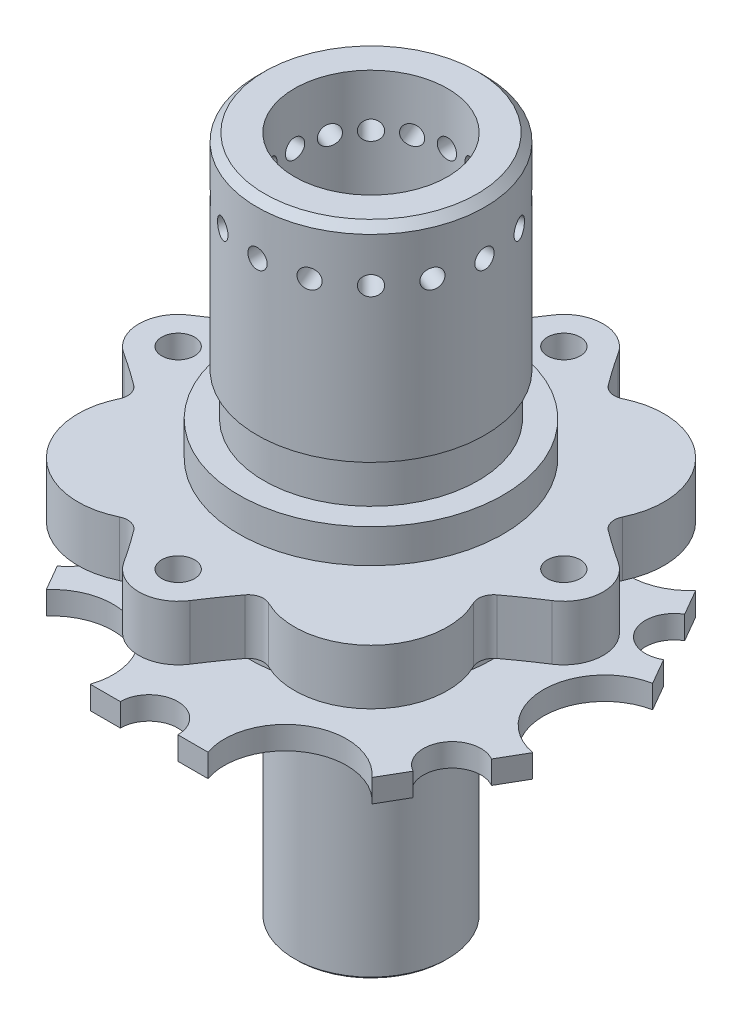
from build123d import *

# Parameters (mm, degrees)
SKETCH5_W                     = 15.875
SKETCH5_H                     = 79.375
SKETCH7_W                     = 3.4
SKETCH7_H                     = 69.85
DRIVE_PIN_HOLES_PATTERN_COUNT = 4
FLANGE_SUPPORT_CUT_REACH      = 104.834
SKETCH8_R                     = 52.5
BRAKE_HAT_HEX_DEPTH           = 4.7625
F_5_16_CLEARNCE_D             = 8.2042
SKETCH14_R                    = 2
PIN_HOLES_DEPTH               = 99.496921864
PIN_HOLE_PATTERN_COUNT        = 16
SKETCH11_R                    = 3.175
TRIPOD_PINS_DEPTH             = 12.7
FILLET1_R                     = 3.175
CIRPATTERN1_COUNT             = 4


with BuildPart() as part:
    # Sketch1 → Bearing Shaft/Flange Support (revolve)
    with BuildSketch(Plane(origin=(0, 0, 0), x_dir=(0, 0, -1), z_dir=(1, 0, 0)), mode=Mode.PRIVATE) as bearing_shaft_flange_support_sk:
        Polygon((0, 0), (-25.0825, 0), (-25.0825, -12.319), (-47.625, -12.319), (-47.625, -17.0815), (-25.0825, -17.0815), (-15.875, -17.0815), (-15.875, -70.64248), (-15.367, -71.15048), (0, -71.15048), align=None)
    revolve(bearing_shaft_flange_support_sk.sketch.rotate(Axis((0, 0, 0), (0, 1, 0)), 180), axis=Axis((0, 0, 0), (0, 1, 0)))

    # Sketch2 → Drive Pin Support (revolve)
    with BuildSketch(Plane(origin=(0, 0, 0), x_dir=(0, 0, -1), z_dir=(1, 0, 0)), mode=Mode.PRIVATE) as drive_pin_support_sk:
        Polygon((0, 0), (-52.5, 0), (-52.5, 11.43), (-27.4096, 11.43), (-27.4096, 18.43), (-22.225, 18.43), (-22.225, 27.305), (-23.61946, 27.305), (-23.61946, 68.2625), (-22.03196, 69.85), (0, 69.85), align=None)
    revolve(drive_pin_support_sk.sketch.rotate(Axis((0, 0, 0), (0, 1, 0)), 180), axis=Axis((0, 0, 0), (0, 1, 0)))

    # Sketch5 → Center Mass Removal (revolve, cut)
    with BuildSketch(Plane(origin=(0, 0, 0), x_dir=(0, 0, -1), z_dir=(1, 0, 0)), mode=Mode.PRIVATE) as center_mass_removal_sk:
        with Locations((7.9375, 30.1625)):
            Rectangle(SKETCH5_W, SKETCH5_H)
    revolve(center_mass_removal_sk.sketch.rotate(Axis((0, 0, 0), (0, -1, 0)), 180), axis=Axis((0, 0, 0), (0, -1, 0)), mode=Mode.SUBTRACT)

    # Sketch7 → Drive Pin Holes (revolve, cut)
    with BuildSketch(Plane(origin=(0, 0, 40), x_dir=(0, 0, -1), z_dir=(1, 0, 0))):
        with Locations((1.7, 34.925)):
            Rectangle(SKETCH7_W, SKETCH7_H)
    drive_pin_holes = revolve(axis=Axis((0, -6.35, 40), (0, 1, 0)), mode=Mode.SUBTRACT)

    # Drive Pin Holes Pattern: Drive Pin Holes ×4 about axis
    drive_pin_holes_pattern_axis = Axis((0, 0, 0), (0, 1, 0))
    for i in range(1, DRIVE_PIN_HOLES_PATTERN_COUNT):
        add(drive_pin_holes.rotate(drive_pin_holes_pattern_axis, i * 360 / DRIVE_PIN_HOLES_PATTERN_COUNT), mode=Mode.SUBTRACT)

    # Sketch8 → Flange Support Cut (cut, up to next)
    with BuildSketch(Plane.XZ, mode=Mode.PRIVATE) as flange_support_cut_sk1:
        Circle(SKETCH8_R)
        with BuildLine():
            ThreePointArc((6.851776468, 44.436165629), (0, 48.1625), (-6.851776468, 44.436165629))
            ThreePointArc((-6.851776468, 44.436165629), (-9.964767607, 39.850591878), (-13.274865482, 35.405206349))
            ThreePointArc((-13.274865482, 35.405206349), (-33.675960454, 33.675960454), (-35.405206349, 13.274865482))
            ThreePointArc((-35.405206349, 13.274865482), (-39.850591878, 9.964767607), (-44.436165629, 6.851776468))
            ThreePointArc((-44.436165629, 6.851776468), (-48.1625, 0), (-44.436165629, -6.851776468))
            ThreePointArc((-44.436165629, -6.851776468), (-39.850591878, -9.964767607), (-35.405206349, -13.274865482))
            ThreePointArc((-35.405206349, -13.274865482), (-33.675960454, -33.675960454), (-13.274865482, -35.405206349))
            ThreePointArc((-13.274865482, -35.405206349), (-9.964767607, -39.850591878), (-6.851776468, -44.436165629))
            ThreePointArc((-6.851776468, -44.436165629), (0, -48.1625), (6.851776468, -44.436165629))
            ThreePointArc((6.851776468, -44.436165629), (9.964767607, -39.850591878), (13.274865482, -35.405206349))
            ThreePointArc((13.274865482, -35.405206349), (33.675960454, -33.675960454), (35.405206349, -13.274865482))
            ThreePointArc((35.405206349, -13.274865482), (39.850591878, -9.964767607), (44.436165629, -6.851776468))
            ThreePointArc((44.436165629, -6.851776468), (48.1625, 0), (44.436165629, 6.851776468))
            ThreePointArc((44.436165629, 6.851776468), (39.850591878, 9.964767607), (35.405206349, 13.274865482))
            ThreePointArc((35.405206349, 13.274865482), (33.675960454, 33.675960454), (13.274865482, 35.405206349))
            ThreePointArc((13.274865482, 35.405206349), (9.964767607, 39.850591878), (6.851776468, 44.436165629))
        make_face(mode=Mode.SUBTRACT)
    flange_support_cut_tool1 = extrude(flange_support_cut_sk1.sketch, amount=-FLANGE_SUPPORT_CUT_REACH, mode=Mode.PRIVATE) & part.part
    add(flange_support_cut_tool1.solids().sort_by_distance((-51.015076, 0, 0))[0], mode=Mode.SUBTRACT)

    # Sketch10 → Brake Hat Hex (cut)
    with BuildSketch(Plane.XZ.offset(17.0815)):
        with BuildLine():
            ThreePointArc((5.969, -46.0375), (0.002019456, -40.068500342), (-5.968998634, -46.033461088))
            Line((-5.968998634, -46.033461088), (-12.209057508, -46.033461088))
            ThreePointArc((-12.209057508, -46.033461088), (-0.007882397, -47.624999348), (12.193818875, -46.0375))
            Line((12.193818875, -46.0375), (5.969, -46.0375))
        make_face()
        with BuildLine():
            ThreePointArc((-33.772735089, -33.578906915), (-23.81932603, -41.240518092), (-12.209057508, -46.033461088))
            ThreePointArc((-12.209057508, -46.033461088), (-17.890731283, -30.975814606), (-33.772735089, -33.578906915))
        make_face()
        with BuildLine():
            ThreePointArc((-45.970675481, -12.443376586), (-41.248400489, -23.805673317), (-33.772735089, -33.578906915))
            Line((-33.772735089, -33.578906915), (-36.885144527, -28.188055635))
            ThreePointArc((-36.885144527, -28.188055635), (-34.699329459, -20.035999071), (-42.850646043, -17.847426092))
            Line((-42.850646043, -17.847426092), (-45.970675481, -12.443376586))
        make_face()
        with BuildLine():
            ThreePointArc((33.761617972, -33.590084503), (17.88047671, -30.981735086), (12.193818875, -46.0375))
            ThreePointArc((12.193818875, -46.0375), (23.805673317, -41.248400489), (33.761617972, -33.590084503))
        make_face()
        with BuildLine():
            ThreePointArc((-45.966553964, 12.458593085), (-47.624999348, 0.007882397), (-45.970675481, -12.443376586))
            ThreePointArc((-45.970675481, -12.443376586), (-35.771207993, 0.005920481), (-45.966553964, 12.458593085))
        make_face()
        with BuildLine():
            Line((36.88164741, -28.186034996), (33.761617972, -33.590084503))
            ThreePointArc((33.761617972, -33.590084503), (41.240518092, -23.81932603), (45.966553964, -12.458593085))
            Line((45.966553964, -12.458593085), (42.854144527, -17.849444365))
            ThreePointArc((42.854144527, -17.849444365), (34.701348915, -20.032501271), (36.88164741, -28.186034996))
        make_face()
        with BuildLine():
            ThreePointArc((-33.761617972, 33.590084503), (-41.240518092, 23.81932603), (-45.966553964, 12.458593085))
            Line((-45.966553964, 12.458593085), (-42.854144527, 17.849444365))
            ThreePointArc((-42.854144527, 17.849444365), (-34.701348915, 20.032501271), (-36.88164741, 28.186034996))
            Line((-36.88164741, 28.186034996), (-33.761617972, 33.590084503))
        make_face()
        with BuildLine():
            ThreePointArc((45.970675481, 12.443376586), (35.771207993, -0.005920481), (45.966553964, -12.458593085))
            ThreePointArc((45.966553964, -12.458593085), (47.624999348, -0.007882397), (45.970675481, 12.443376586))
        make_face()
        with BuildLine():
            ThreePointArc((-12.193818875, 46.0375), (-23.805673317, 41.248400489), (-33.761617972, 33.590084503))
            ThreePointArc((-33.761617972, 33.590084503), (-17.88047671, 30.981735086), (-12.193818875, 46.0375))
        make_face()
        with BuildLine():
            Line((42.850646043, 17.847426092), (45.970675481, 12.443376586))
            ThreePointArc((45.970675481, 12.443376586), (41.248400489, 23.805673317), (33.772735089, 33.578906915))
            Line((33.772735089, 33.578906915), (36.885144527, 28.188055635))
            ThreePointArc((36.885144527, 28.188055635), (34.699329459, 20.035999071), (42.850646043, 17.847426092))
        make_face()
        with BuildLine():
            ThreePointArc((12.209057508, 46.033461088), (0.007882397, 47.624999348), (-12.193818875, 46.0375))
            Line((-12.193818875, 46.0375), (-5.969, 46.0375))
            ThreePointArc((-5.969, 46.0375), (-0.002019456, 40.068500342), (5.968998634, 46.033461088))
            Line((5.968998634, 46.033461088), (12.209057508, 46.033461088))
        make_face()
        with BuildLine():
            ThreePointArc((12.209057508, 46.033461088), (17.890731283, 30.975814606), (33.772735089, 33.578906915))
            ThreePointArc((33.772735089, 33.578906915), (23.81932603, 41.240518092), (12.209057508, 46.033461088))
        make_face()
    extrude(amount=-BRAKE_HAT_HEX_DEPTH, mode=Mode.SUBTRACT)

    # 5/16 Clearnce (through all)
    with Locations(Plane(origin=(0, -71.15048, 0), x_dir=(-1, 0, 0), z_dir=(0, -1, 0))):
        with Locations((0, 0)):
            Hole(F_5_16_CLEARNCE_D / 2)

    # Sketch14 → Pin Holes (cut, through all)
    with BuildSketch(Plane(origin=(0, 0, 0), x_dir=(0, 0, -1), z_dir=(1, 0, 0))):
        with Locations((0, 59.05)):
            Circle(SKETCH14_R)
    pin_holes = extrude(amount=-PIN_HOLES_DEPTH, mode=Mode.SUBTRACT)

    # Pin Hole Pattern: Pin Holes ×16 about axis
    pin_hole_pattern_axis = Axis((0, 0, 0), (0, -1, 0))
    for i in range(1, PIN_HOLE_PATTERN_COUNT):
        add(pin_holes.rotate(pin_hole_pattern_axis, i * 360 / PIN_HOLE_PATTERN_COUNT), mode=Mode.SUBTRACT)

    # Sketch11 → Tripod Pins (cut)
    with BuildSketch(Plane.XZ.offset(71.15048)):
        with Locations(Location((0, 9.525, 0), (0, 0, 270))):
            Circle(SKETCH11_R)
    tripod_pins = extrude(amount=-TRIPOD_PINS_DEPTH, mode=Mode.SUBTRACT)

    # Fillet1
    fillet1_edges = [part.edges().sort_by_distance(p)[0] for p in [
        (-35.405206349, 5.715, -13.274865482),
        (-13.274865482, 5.715, -35.405206349),
        (13.274865482, 5.715, -35.405206349),
        (35.405206349, 5.715, -13.274865482),
        (35.405206349, 5.715, 13.274865482),
        (13.274865482, 5.715, 35.405206349),
        (-13.274865482, 5.715, 35.405206349),
        (-35.405206349, 5.715, 13.274865482),
    ]]
    fillet(fillet1_edges, radius=FILLET1_R)

    # CirPattern1: Tripod Pins ×4 about axis
    cirpattern1_axis = Axis((0, 0, 0), (0, 1, 0))
    for i in range(1, CIRPATTERN1_COUNT):
        add(tripod_pins.rotate(cirpattern1_axis, i * 360 / CIRPATTERN1_COUNT), mode=Mode.SUBTRACT)


solid = part.part
